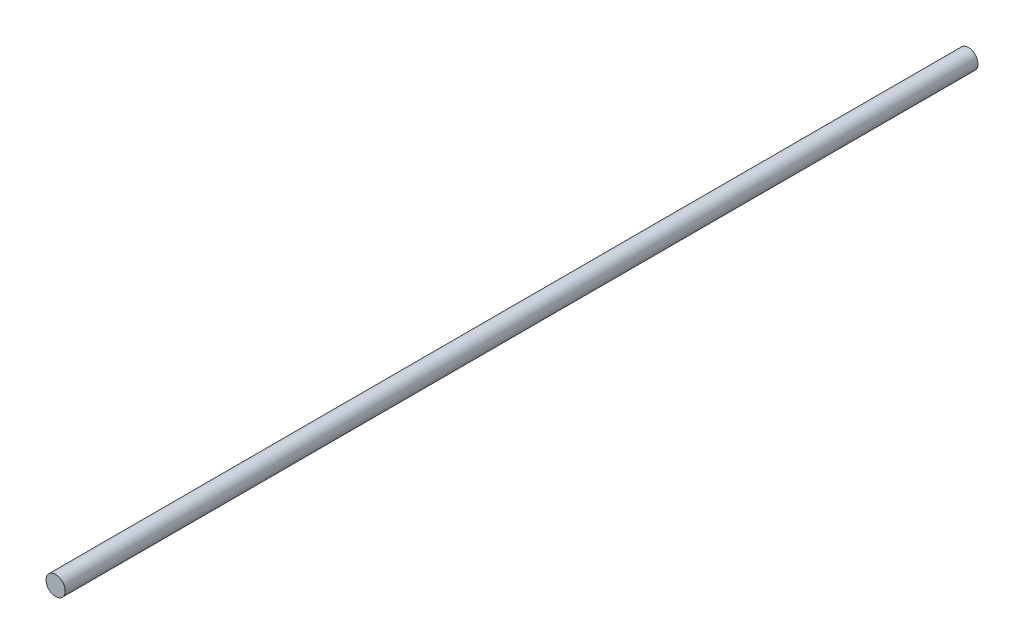
from build123d import *

# Parameters (mm, degrees)
SKETCH1_R           = 4
BOSS_EXTRUDE1_DEPTH = 380


with BuildPart() as part:
    # Sketch1 → Boss-Extrude1 (new body)
    with BuildSketch(Plane.XY):
        Circle(SKETCH1_R)
    extrude(amount=BOSS_EXTRUDE1_DEPTH)


solid = part.part
